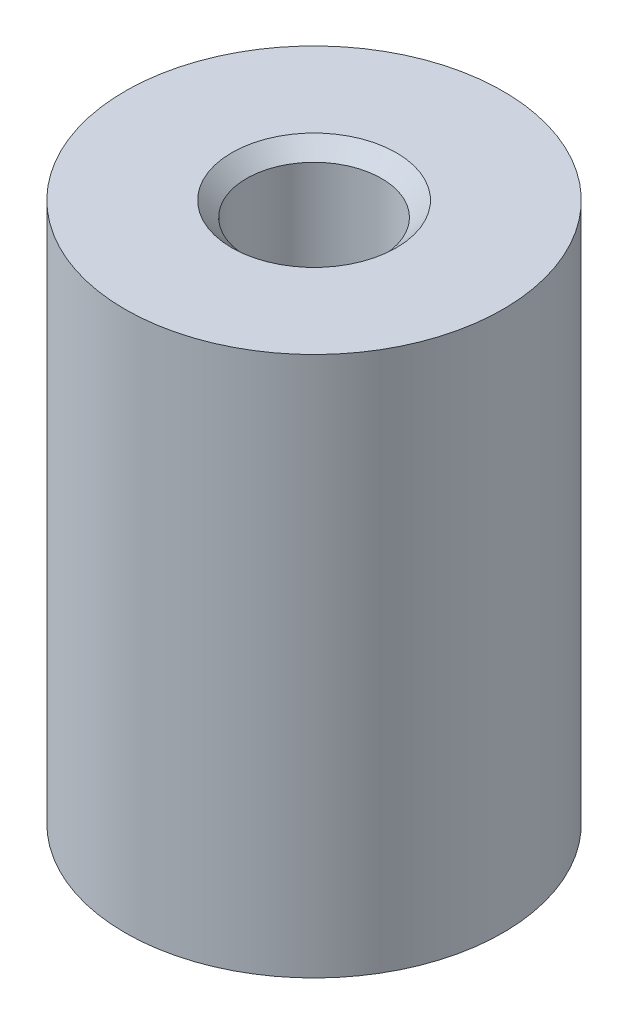
from build123d import *

# Parameters (mm, degrees)
SKIZZE1_R                       = 3.5
AUFSATZ_LINEAR_AUSTRAGEN1_DEPTH = 10
M3_GEWINDEBOHRUNG1_D            = 2.5
M3_GEWINDEBOHRUNG1_CSINK_D      = 3.05
M3_GEWINDEBOHRUNG1_CSINK_ANGLE  = 90


with BuildPart() as part:
    # Skizze1 → Aufsatz-Linear austragen1 (new body)
    with BuildSketch(Plane(origin=(0, 0, 0), x_dir=(1, 0, 0), z_dir=(0, 1, 0))):
        with Locations(Location((-1.867524313, 0, 0), (0, 0, 270))):
            Circle(SKIZZE1_R)
    extrude(amount=AUFSATZ_LINEAR_AUSTRAGEN1_DEPTH)

    # M3 Gewindebohrung1 (through all)
    with Locations(Plane(origin=(0, 10, 0), x_dir=(1, 0, 0), z_dir=(0, 1, 0))):
        with Locations((-1.867524313, 0)):
            CounterSinkHole(M3_GEWINDEBOHRUNG1_D / 2, M3_GEWINDEBOHRUNG1_CSINK_D / 2, counter_sink_angle=M3_GEWINDEBOHRUNG1_CSINK_ANGLE)


solid = part.part
